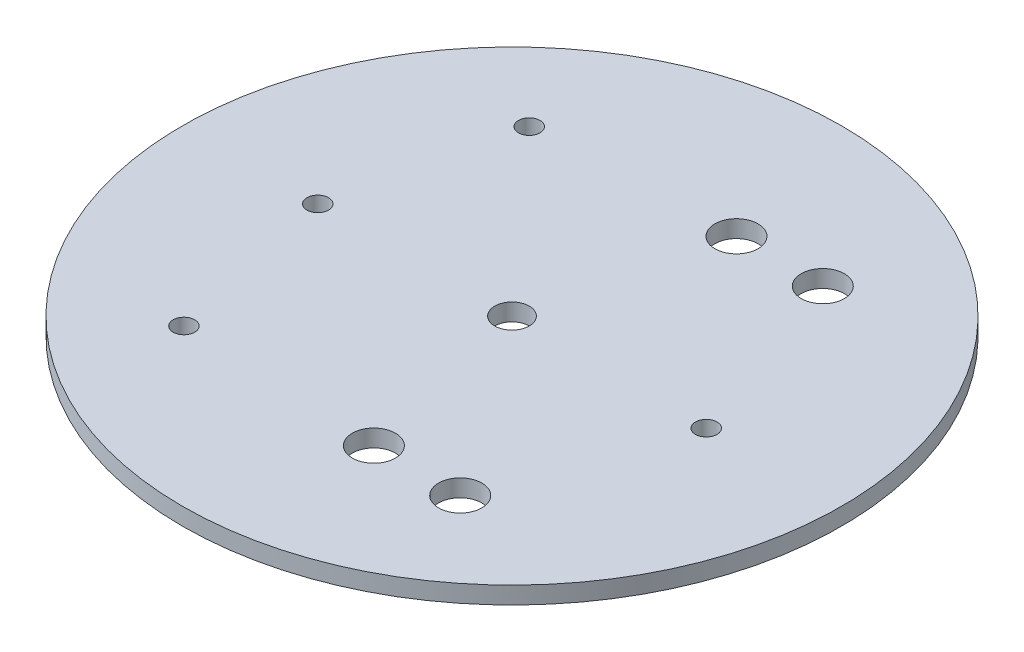
from build123d import *

# Parameters (mm, degrees)
SKETCH1_R           = 76.35
SKETCH1_R_2         = 2.5
SKETCH1_R_3         = 4
SKETCH1_R_4         = 5
BOSS_EXTRUDE1_DEPTH = 4


with BuildPart() as part:
    # Sketch1 → Boss-Extrude1 (new body)
    with BuildSketch(Plane(origin=(0, 0, 0), x_dir=(1, 0, 0), z_dir=(0, 1, 0))):
        with Locations(Location((0, 0, 0), (0, 0, 270))):
            Circle(SKETCH1_R)
        with Locations(Location((-45, 0, 0), (0, 0, 270))):
            Circle(SKETCH1_R_2, mode=Mode.SUBTRACT)
        with Locations(Location((45, 0, 0), (0, 0, 270))):
            Circle(SKETCH1_R_2, mode=Mode.SUBTRACT)
        with Locations(Location((0, 0, 0), (0, 0, 270))):
            Circle(SKETCH1_R_3, mode=Mode.SUBTRACT)
        with Locations(Location((-36, 40, 0), (0, 0, 270))):
            Circle(SKETCH1_R_2, mode=Mode.SUBTRACT)
        with Locations(Location((10, 42, 0), (0, 0, 270))):
            Circle(SKETCH1_R_4, mode=Mode.SUBTRACT)
        with Locations(Location((30, 42, 0), (0, 0, 270))):
            Circle(SKETCH1_R_4, mode=Mode.SUBTRACT)
        with Locations(Location((30, -42, 0), (0, 0, 270))):
            Circle(SKETCH1_R_4, mode=Mode.SUBTRACT)
        with Locations(Location((10, -42, 0), (0, 0, 270))):
            Circle(SKETCH1_R_4, mode=Mode.SUBTRACT)
        with Locations(Location((-36, -40, 0), (0, 0, 270))):
            Circle(SKETCH1_R_2, mode=Mode.SUBTRACT)
    extrude(amount=BOSS_EXTRUDE1_DEPTH)


solid = part.part
